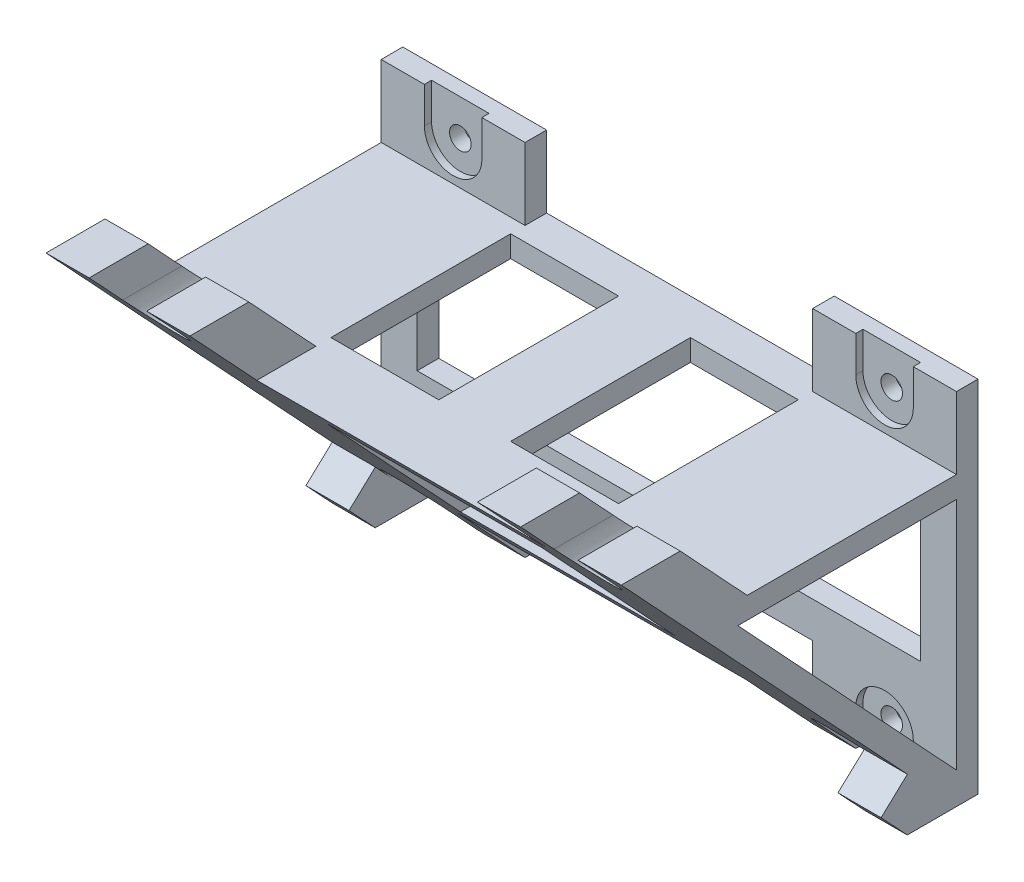
from build123d import *

# Parameters (mm, degrees)
EXTRUDE_2_DEPTH     = 2
SKETCH_3_R          = 1.5
CUT_EXTRUDE_1_DEPTH = 95.361008897
EXTRUDE_3_DEPTH     = 1
DRAFT_4_ANGLE       = 43
SKETCH_6_W          = 6
SKETCH_6_H          = 10
EXTRUDE_4_DEPTH     = 5
SKETCH_7_W          = 6
SKETCH_7_H          = 10
EXTRUDE_5_DEPTH     = 5
CUT_EXTRUDE_2_DEPTH = 107.596038813
CUT_EXTRUDE_4_DEPTH = 107.596038813
CUT_EXTRUDE_5_DEPTH = 107.596038813
CUT_EXTRUDE_6_DEPTH = 107.596038813
SKETCH_15_W         = 30
SKETCH_15_H         = 20
CUT_EXTRUDE_7_DEPTH = 107.596038813
SKETCH_16_W         = 20
SKETCH_16_H         = 20
CUT_EXTRUDE_8_DEPTH = 5
SKETCH_17_W         = 15
SKETCH_17_H         = 25
CUT_EXTRUDE_9_DEPTH = 5


with BuildPart() as part:
    # 草图1 → 凸台-拉伸2 (new body)
    with BuildSketch(Plane.XY):
        Polygon((0, 0), (0, 50), (20, 50), (20, 40), (60, 40), (60, 50), (80, 50), (80, 0), (60, 0), (60, 10), (20, 10), (20, 0), align=None)
    extrude(amount=EXTRUDE_2_DEPTH)

    # 草图3 → 切除-拉伸1 (cut, through all)
    with BuildSketch(Plane.XY.offset(2)):
        with Locations((10, 45)):
            Circle(SKETCH_3_R)
        with Locations((10, 5)):
            Circle(SKETCH_3_R)
        with Locations((70, 45)):
            Circle(SKETCH_3_R)
        with Locations((70, 5)):
            Circle(SKETCH_3_R)
    extrude(amount=-CUT_EXTRUDE_1_DEPTH, mode=Mode.SUBTRACT)

    # 草图5 → 凸台-拉伸3 (add)
    with BuildSketch(Plane.XY.offset(2)):
        with BuildLine():
            Line((0, 50), (6, 50))
            Line((6, 50), (6, 45))
            ThreePointArc((6, 45), (10, 41), (14, 45))
            Line((14, 45), (14, 50))
            Line((14, 50), (20, 50))
            Line((20, 50), (20, 40))
            Line((20, 40), (60, 40))
            Line((60, 40), (60, 50))
            Line((60, 50), (66, 50))
            Line((66, 50), (66, 45))
            ThreePointArc((66, 45), (70, 41), (74, 45))
            Line((74, 45), (74, 50))
            Line((74, 50), (80, 50))
            Line((80, 50), (80, 0))
            Line((80, 0), (74, 0))
            Line((74, 0), (74, 5))
            ThreePointArc((74, 5), (70, 9), (66, 5))
            Line((66, 5), (66, 0))
            Line((66, 0), (60, 0))
            Line((60, 0), (60, 10))
            Line((60, 10), (20, 10))
            Line((20, 10), (20, 0))
            Line((20, 0), (14, 0))
            Line((14, 0), (14, 5))
            ThreePointArc((14, 5), (10, 9), (6, 5))
            Line((6, 5), (6, 0))
            Line((6, 0), (0, 0))
            Line((0, 0), (0, 50))
        make_face()
    extrude(amount=EXTRUDE_3_DEPTH)

    # 拔模4
    draft_4_faces = [part.faces().sort_by_distance(p)[0] for p in [
        (40, 25, 3),
    ]]
    draft(draft_4_faces, Plane(origin=(20, 0, 2), x_dir=(-1, 0, 0), z_dir=(0, -1, 0)), DRAFT_4_ANGLE)

    # 草图6 → 凸台-拉伸4 (add)
    with BuildSketch(Plane(origin=(0, -1.496346075, 1.604634711), x_dir=(1, 0, 0), z_dir=(0, -0.6819983600624997, 0.7313537016191695))):
        with Locations((3, 7.04599508)):
            Rectangle(SKETCH_6_W, SKETCH_6_H)
    extrude(amount=EXTRUDE_4_DEPTH)

    # 草图7 → 凸台-拉伸5 (add)
    with BuildSketch(Plane(origin=(0, -1.496346075, 1.604634711), x_dir=(1, 0, 0), z_dir=(0, -0.6819983600624997, 0.7313537016191695))):
        with Locations((77, 7.04599508)):
            Rectangle(SKETCH_7_W, SKETCH_7_H)
    extrude(amount=EXTRUDE_5_DEPTH)

    # 草图8 → 切除-拉伸2 (cut, through all)
    with BuildSketch(Plane(origin=(80, 0, 0), x_dir=(0, 0, -1), z_dir=(1, 0, 0))):
        Polygon((-3, 0), (-9.836637305, 0), (-6.656768508, -3.4099918), align=None)
    extrude(amount=-CUT_EXTRUDE_2_DEPTH, mode=Mode.SUBTRACT)

    # 草图11 → 切除-拉伸4 (cut, through all)
    with BuildSketch(Plane(origin=(80, 0, 0), x_dir=(0, 0, -1), z_dir=(1, 0, 0))):
        Polygon((-3, 37), (-3, 13), (-11.020713736, 13), (-33.401075804, 37), align=None)
    extrude(amount=-CUT_EXTRUDE_4_DEPTH, mode=Mode.SUBTRACT)

    # 草图12 → 切除-拉伸5 (cut, through all)
    with BuildSketch(Plane(origin=(80, 0, 0), x_dir=(0, 0, -1), z_dir=(1, 0, 0))):
        Polygon((-3, 50), (-41.42178954, 50), (-32.096638679, 40), (-3, 40), align=None)
    extrude(amount=-CUT_EXTRUDE_5_DEPTH, mode=Mode.SUBTRACT)

    # 草图14 → 切除-拉伸6 (cut, through all)
    with BuildSketch(Plane(origin=(80, 0, 0), x_dir=(0, 0, -1), z_dir=(1, 0, 0))):
        Polygon((-11.020713736, 13), (-3, 4.398837557), (-3, 13), align=None)
    extrude(amount=-CUT_EXTRUDE_6_DEPTH, mode=Mode.SUBTRACT)

    # 草图15 → 切除-拉伸7 (cut, through all)
    with BuildSketch(Plane(origin=(0, 0, 0), x_dir=(-1, 0, 0), z_dir=(0, 0, -1))):
        with Locations((-40, 25)):
            Rectangle(SKETCH_15_W, SKETCH_15_H)
    extrude(amount=-CUT_EXTRUDE_7_DEPTH, mode=Mode.SUBTRACT)

    # 草图16 → 切除-拉伸8 (cut)
    with BuildSketch(Plane(origin=(0, 0, 0), x_dir=(-1, 0, 0), z_dir=(0, 0, -1))):
        with Locations((-15, 25)):
            Rectangle(SKETCH_16_W, SKETCH_16_H)
        with Locations((-65, 25)):
            Rectangle(SKETCH_16_W, SKETCH_16_H)
    extrude(amount=-CUT_EXTRUDE_8_DEPTH, mode=Mode.SUBTRACT)

    # 草图17 → 切除-拉伸9 (cut)
    with BuildSketch(Plane(origin=(0, 40, 0), x_dir=(1, 0, 0), z_dir=(0, 1, 0))):
        with Locations((52.5, -17.5)):
            Rectangle(SKETCH_17_W, SKETCH_17_H)
        with Locations((27.5, -17.5)):
            Rectangle(SKETCH_17_W, SKETCH_17_H)
    extrude(amount=-CUT_EXTRUDE_9_DEPTH, mode=Mode.SUBTRACT)


solid = part.part
